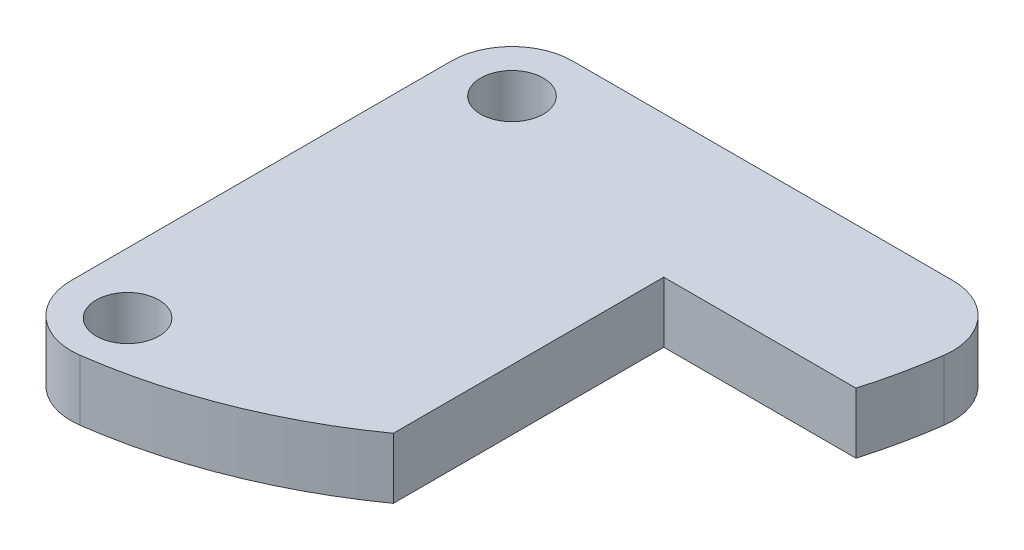
from build123d import *

# Parameters (mm, degrees)
SKETCH1_W           = 25
SKETCH1_H           = 25
SKETCH1_R           = 1.55
BOSS_EXTRUDE1_DEPTH = 3
SKETCH2_W           = 10.5
SKETCH2_H           = 18
CUT_EXTRUDE1_DEPTH  = 18.930421077
CUT_EXTRUDE2_DEPTH  = 18.930421077
FILLET2_R           = 3


with BuildPart() as part:
    # Sketch1 → Boss-Extrude1 (new body)
    with BuildSketch(Plane(origin=(0, 0, 0), x_dir=(1, 0, 0), z_dir=(0, 1, 0))):
        Rectangle(SKETCH1_W, SKETCH1_H)
        with Locations(Location((-9.5, 9.5, 0), (0, 0, 270))):
            Circle(SKETCH1_R, mode=Mode.SUBTRACT)
        with Locations(Location((-9.5, -9.5, 0), (0, 0, 270))):
            Circle(SKETCH1_R, mode=Mode.SUBTRACT)
    extrude(amount=-BOSS_EXTRUDE1_DEPTH)

    # Sketch2 → Cut-Extrude1 (cut, through all)
    with BuildSketch(Plane(origin=(0, 0, 0), x_dir=(1, 0, 0), z_dir=(0, 1, 0))):
        with Locations((7.25, -3.5)):
            Rectangle(SKETCH2_W, SKETCH2_H)
    extrude(amount=-CUT_EXTRUDE1_DEPTH, mode=Mode.SUBTRACT)

    # Sketch3 → Cut-Extrude2 (cut, through all)
    with BuildSketch(Plane(origin=(0, 0, 0), x_dir=(1, 0, 0), z_dir=(0, 1, 0))):
        with BuildLine():
            Line((-12.5, -12.5), (12.5, -12.5))
            Line((12.5, -12.5), (12.5, 12.5))
            ThreePointArc((12.5, 12.5), (5.17766953, -5.17766953), (-12.5, -12.5))
        make_face()
    extrude(amount=-CUT_EXTRUDE2_DEPTH, mode=Mode.SUBTRACT)

    # Fillet2
    fillet2_edges = [part.edges().sort_by_distance(p)[0] for p in [
        (-12.5, -1.5, 12.5),
        (-12.5, -1.5, -12.5),
        (12.5, -1.5, -12.5),
    ]]
    fillet(fillet2_edges, radius=FILLET2_R)


solid = part.part
